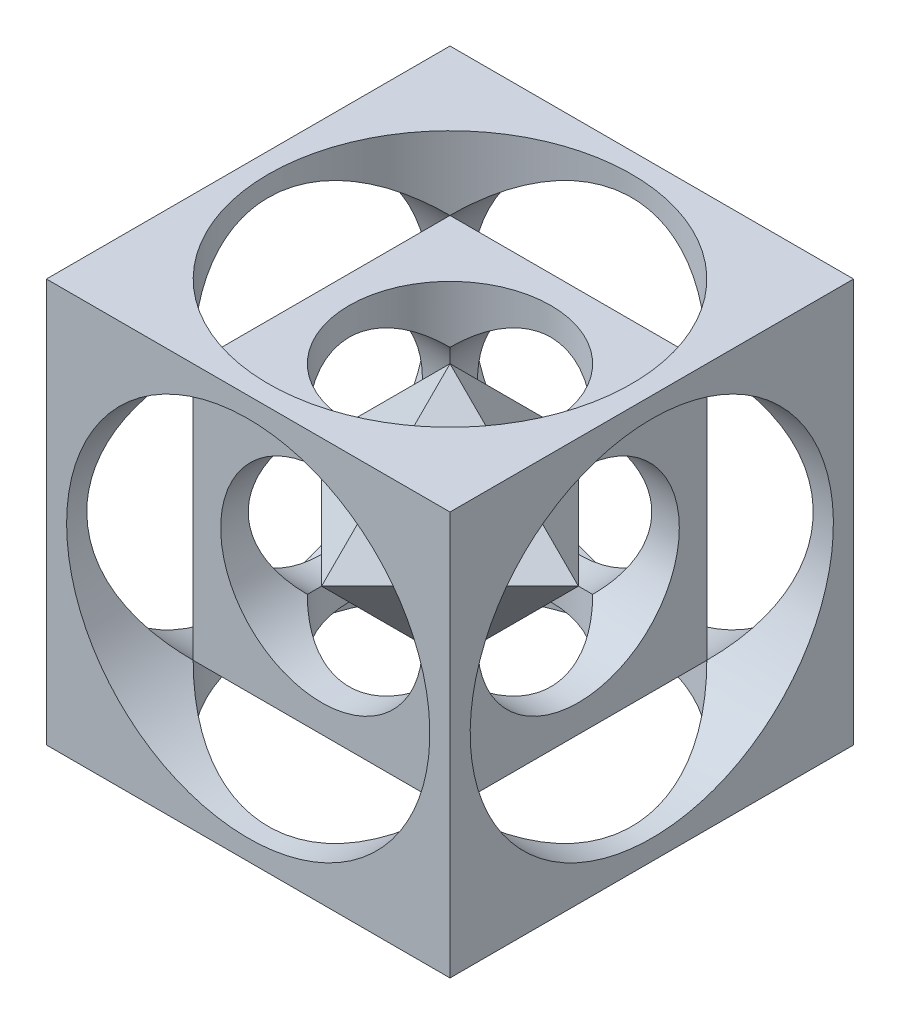
from build123d import *

# Parameters (mm, degrees)
SKETCH_1_W               = 50
SKETCH_1_H               = 50
EXTRUDE_1_DEPTH          = 25
SKETCH_2_R               = 22.5
CUT_EXTRUDE_1_DEPTH      = 62.23724357
PATTERN_CIRCULAR_1_COUNT = 4
SKETCH_3_R               = 22.5
CUT_EXTRUDE_2_DEPTH      = 62.23724357
EXTRUDE_3_DEPTH          = 15.909903
EXTRUDE_3_DEPTH_BACK     = 15.909903
SKETCH_4_W               = 31.819805154
SKETCH_4_H               = 31.819805154
SKETCH_4_R               = 12.5
CUT_EXTRUDE_4_REACH      = 56.071
SKETCH_6_R               = 12.5
CUT_EXTRUDE_5_REACH      = 56.071
SKETCH_7_R               = 12.5


with BuildPart() as part:
    # 草图1 → 凸台-拉伸1 (new, symmetric)
    with BuildSketch(Plane.XY):
        Rectangle(SKETCH_1_W, SKETCH_1_H)
    extrude(amount=EXTRUDE_1_DEPTH, both=True)

    # 草图2 → 切除-拉伸1 (cut, through all)
    with BuildSketch(Plane(origin=(25, 0, 0), x_dir=(0, 0, -1), z_dir=(1, 0, 0))):
        with Locations(Location((0, 0, 0), (0, 0, 90))):
            Circle(SKETCH_2_R)
    cut_extrude_1 = extrude(amount=-CUT_EXTRUDE_1_DEPTH, mode=Mode.SUBTRACT)

    # 阵列(圆周)1: 切除-拉伸1 ×4 about axis
    pattern_circular_1_axis = Axis((0, 0, 0), (0, 0, 1))
    for i in range(1, PATTERN_CIRCULAR_1_COUNT):
        add(cut_extrude_1.rotate(pattern_circular_1_axis, i * 360 / PATTERN_CIRCULAR_1_COUNT), mode=Mode.SUBTRACT)

    # 草图3 → 切除-拉伸2 (cut, through all)
    with BuildSketch(Plane(origin=(0, 0, -25), x_dir=(-1, 0, 0), z_dir=(0, 0, -1))):
        Circle(SKETCH_3_R)
    extrude(amount=-CUT_EXTRUDE_2_DEPTH, mode=Mode.SUBTRACT)


with BuildPart() as body_2:
    # 草图4 → 凸台-拉伸3 (new, two sides: drawn at the far end of the back side and taken through both)
    with BuildSketch(Plane.XY.offset(-EXTRUDE_3_DEPTH_BACK)):
        Rectangle(SKETCH_4_W, SKETCH_4_H)
        Circle(SKETCH_4_R, mode=Mode.SUBTRACT)
    extrude(amount=EXTRUDE_3_DEPTH + EXTRUDE_3_DEPTH_BACK)

    # 切除-拉伸4: up to this face of the body (flat: up to its plane)
    cut_extrude_4_end = Plane(body_2.part.faces().sort_by_distance((-15.909902577, 0, 0))[0])
    # 草图6 → 切除-拉伸4 (cut, up to the picked face)
    with BuildSketch(Plane(origin=(15.909902577, 0, 0), x_dir=(0, 0, -1), z_dir=(1, 0, 0)), mode=Mode.PRIVATE) as cut_extrude_4_sk1:
        with Locations(Location((0, 0, 0), (0, 0, 90))):
            Circle(SKETCH_6_R)
    cut_extrude_4_tool1 = split(extrude(cut_extrude_4_sk1.sketch, amount=-CUT_EXTRUDE_4_REACH, mode=Mode.PRIVATE), bisect_by=cut_extrude_4_end, keep=Keep.BOTH, mode=Mode.PRIVATE)
    add(cut_extrude_4_tool1.solids().sort_by(Axis((15.909903, 0, 0), (-1, 0, 0)))[0], mode=Mode.SUBTRACT)

    # 切除-拉伸5: up to this face of the body (flat: up to its plane)
    cut_extrude_5_end = Plane(body_2.part.faces().sort_by_distance((0, 15.909902577, 0))[0])
    # 草图7 → 切除-拉伸5 (cut, up to the picked face)
    with BuildSketch(Plane.XZ.offset(15.909902577), mode=Mode.PRIVATE) as cut_extrude_5_sk1:
        with Locations(Location((0, 0, 0), (0, 0, 270))):
            Circle(SKETCH_7_R)
    cut_extrude_5_tool1 = split(extrude(cut_extrude_5_sk1.sketch, amount=-CUT_EXTRUDE_5_REACH, mode=Mode.PRIVATE), bisect_by=cut_extrude_5_end, keep=Keep.BOTH, mode=Mode.PRIVATE)
    add(cut_extrude_5_tool1.solids().sort_by(Axis((0, -15.909903, 0), (0, 1, 0)))[0], mode=Mode.SUBTRACT)


with BuildPart() as body_3:
    # 草图14 → 放样3 section 0
    with BuildSketch(Plane.XY, mode=Mode.PRIVATE) as loft_3_s0:
        with BuildLine():
            Line((0, 15.909902577), (-15.909902577, 0))
            Line((-15.909902577, 0), (0, -15.909902577))
            Line((0, -15.909902577), (15.909902577, 0))
            Line((15.909902577, 0), (0, 15.909902577))
        make_face()
    loft([loft_3_s0.sketch, Vertex(0, 0, 15.909902577)])


with BuildPart() as body_4:
    # 镜向3: mirrored copy
    add(body_3.part.mirror(Plane.XY))


solid = Compound([part.part, body_2.part, body_3.part, body_4.part])
